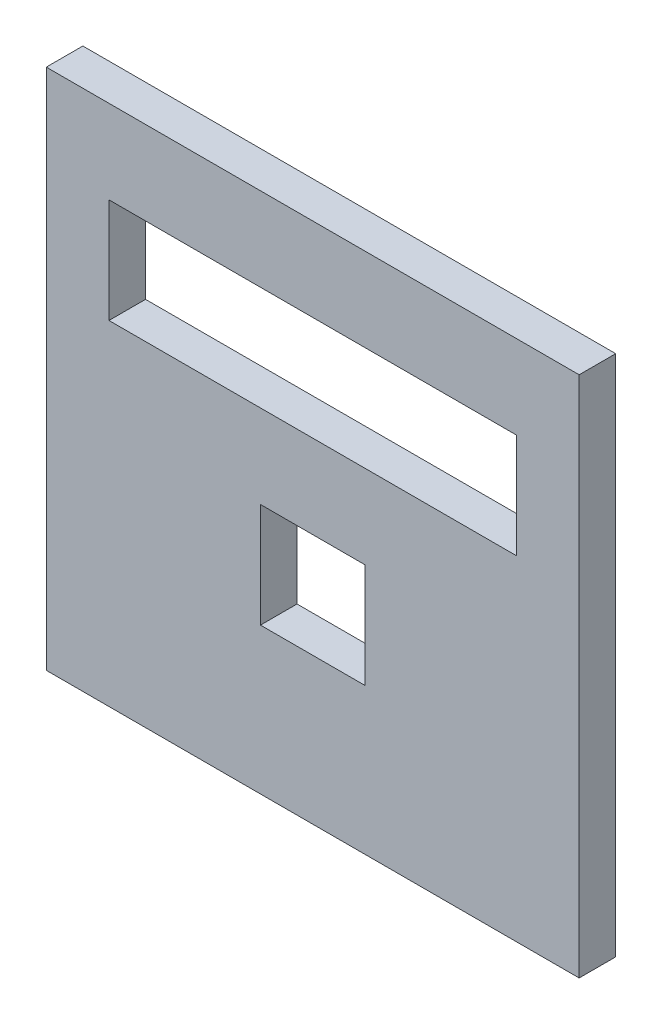
from build123d import *

# Parameters (mm, degrees)
SKETCH1_W           = 5
SKETCH1_H           = 5
SKETCH1_W_2         = 19.5
BOSS_EXTRUDE1_DEPTH = 1.75


with BuildPart() as part:
    # Sketch1 → Boss-Extrude1 (new body)
    with BuildSketch(Plane.XY):
        Polygon((-12.75, 15), (-9.75, 15), (9.75, 15), (12.75, 15), (12.75, 10), (12.75, -10), (-12.75, -10), (-12.75, 10), align=None)
        with Locations((0, -0.5)):
            Rectangle(SKETCH1_W, SKETCH1_H, mode=Mode.SUBTRACT)
        with Locations((0, 8.5)):
            Rectangle(SKETCH1_W_2, SKETCH1_H, mode=Mode.SUBTRACT)
    extrude(amount=BOSS_EXTRUDE1_DEPTH)


solid = part.part
